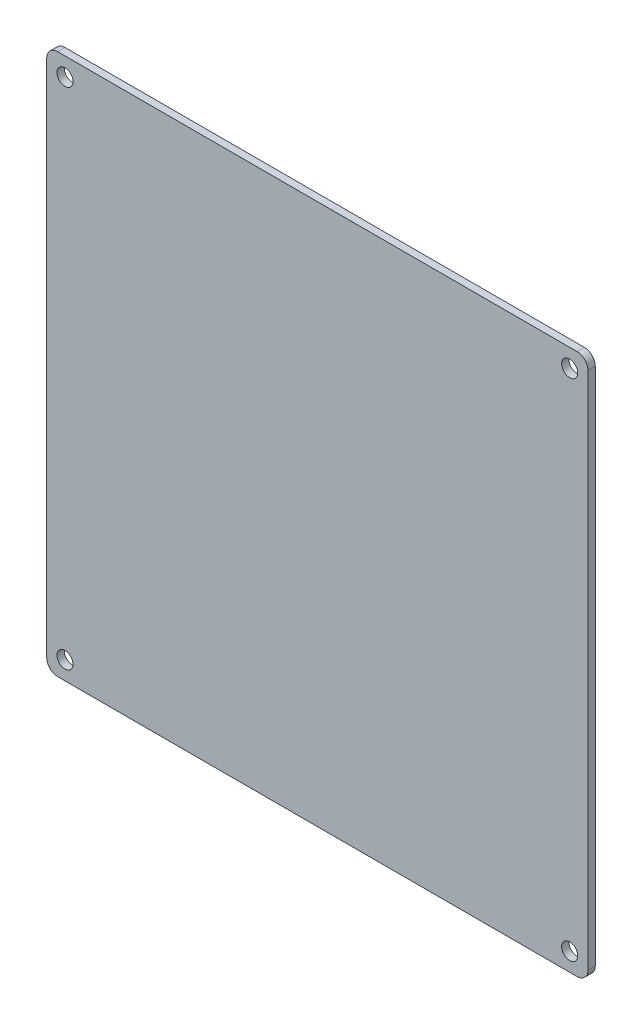
from build123d import *

# Parameters (mm, degrees)
SKETCH_1_W      = 74
SKETCH_1_H      = 74
SKETCH_1_R      = 1.1
EXTRUDE_1_DEPTH = 1
FILLET_1_R      = 1.5


with BuildPart() as part:
    # 草图1 → 凸台-拉伸1 (new body)
    with BuildSketch(Plane.XY):
        Rectangle(SKETCH_1_W, SKETCH_1_H)
        with Locations((-34.5, 34.5)):
            Circle(SKETCH_1_R, mode=Mode.SUBTRACT)
        with Locations((34.5, 34.5)):
            Circle(SKETCH_1_R, mode=Mode.SUBTRACT)
        with Locations((34.5, -34.5)):
            Circle(SKETCH_1_R, mode=Mode.SUBTRACT)
        with Locations((-34.5, -34.5)):
            Circle(SKETCH_1_R, mode=Mode.SUBTRACT)
    extrude(amount=EXTRUDE_1_DEPTH)

    # 圆角1
    fillet_1_edges = [part.edges().sort_by_distance(p)[0] for p in [
        (37, -37, 0.5),
        (-37, -37, 0.5),
        (-37, 37, 0.5),
        (37, 37, 0.5),
    ]]
    fillet(fillet_1_edges, radius=FILLET_1_R)


solid = part.part
